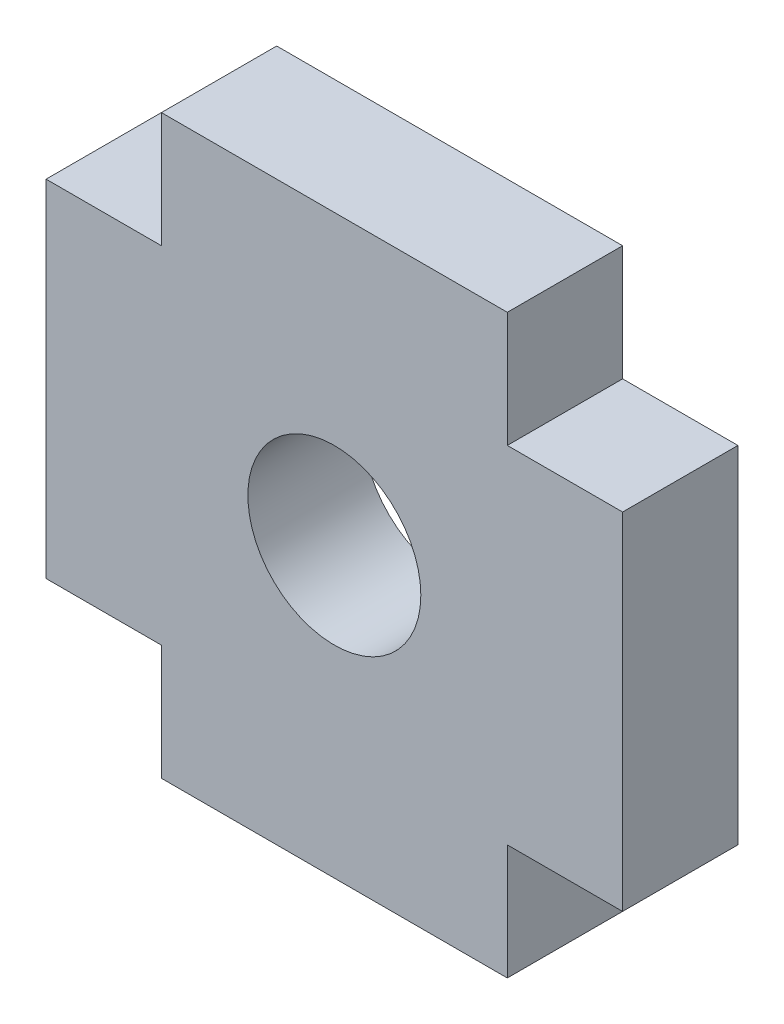
from build123d import *

# Parameters (mm, degrees)
MODEL_R             = 1.5
BOSS_EXTRUDE1_DEPTH = 2


with BuildPart() as part:
    # Model → Boss-Extrude1 (new body)
    with BuildSketch(Plane.XY):
        Polygon((2078.675952636, 1290.223478901), (2080.675952636, 1290.223478901), (2080.675952636, 1288.223478901), (2086.675952636, 1288.223478901), (2086.675952636, 1290.223478901), (2088.675952636, 1290.223478901), (2088.675952636, 1296.223478901), (2086.675952636, 1296.223478901), (2086.675952636, 1298.223478901), (2080.675952636, 1298.223478901), (2080.675952636, 1296.223478901), (2078.675952636, 1296.223478901), align=None)
        with Locations((2083.675952636, 1293.223478901)):
            Circle(MODEL_R, mode=Mode.SUBTRACT)
    extrude(amount=BOSS_EXTRUDE1_DEPTH)


solid = part.part
